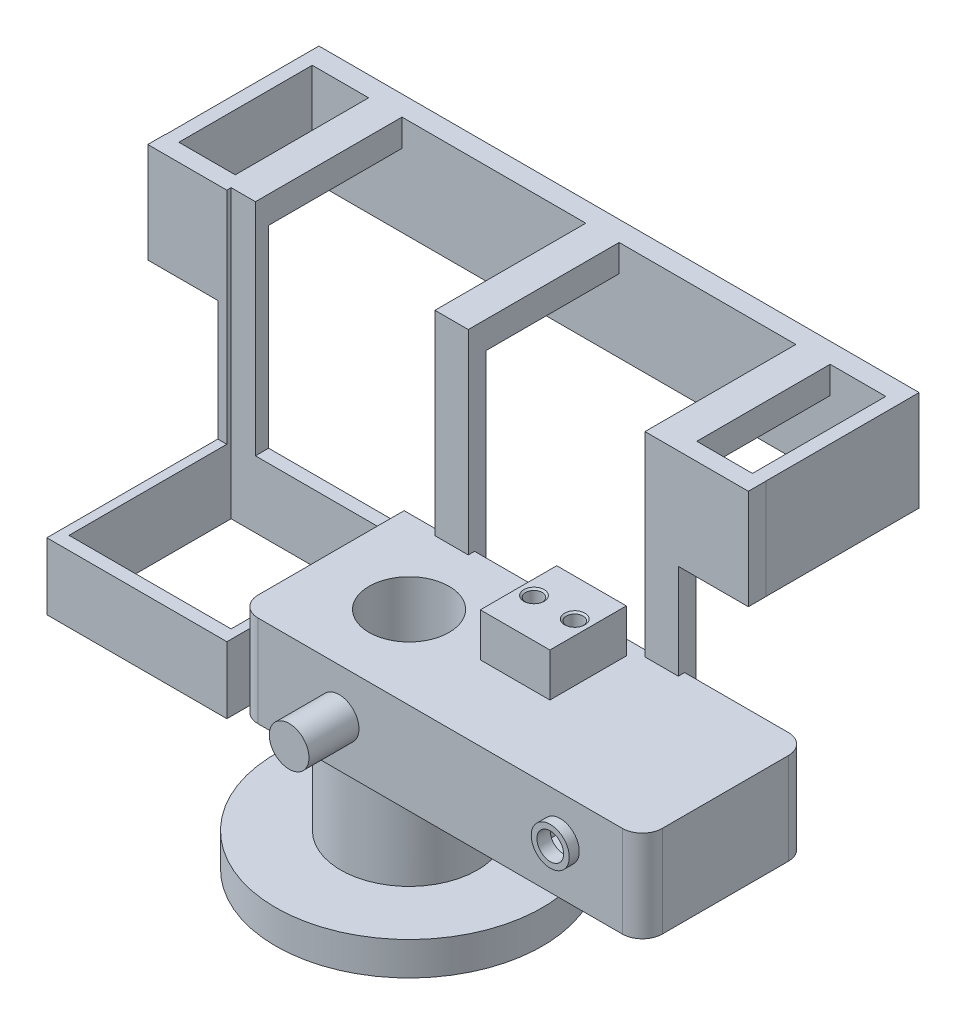
from build123d import *
from build123d.topology import SkipClean

# Parameters (mm, degrees)
SKETCH_1_W                   = 60.60764715
SKETCH_1_H                   = 24.895940982
EXTRUDE_1_DEPTH              = 13.730426318
SKETCH_2_W                   = 12.5
SKETCH_2_H                   = 10.5
CUT_EXTRUDE_1_DEPTH          = 42.553028861
SKETCH_3_W                   = 12.5
SKETCH_3_H                   = 10.5
EXTRUDE_2_DEPTH              = 0.5
SKETCH_4_R                   = 2
CUT_EXTRUDE_2_DEPTH          = 42.255402877
SKETCH_5_R                   = 2.975
EXTRUDE_3_DEPTH              = 7.5
SKETCH_10_W                  = 10.431635196
SKETCH_10_H                  = 11.456709174
EXTRUDE_4_DEPTH              = 6.5
SKETCH_14_R                  = 2.850486714
SKETCH_14_R_2                = 2
EXTRUDE_5_DEPTH              = 1.5
FILLET_2_R                   = 3
FILLET_3_R                   = 3
FILLET_4_R                   = 3
SKETCH_16_R                  = 7.5
SKETCH_16_R_2                = 5.5
EXTRUDE_6_DEPTH              = 15
SKETCH_17_R                  = 17.05
SKETCH_17_R_2                = 9.15
EXTRUDE_7_DEPTH              = 5
SKETCH_18_R                  = 10.251372135
EXTRUDE_8_DEPTH              = 15
SKETCH_19_R                  = 6
CUT_EXTRUDE_3_DEPTH          = 53.976583263
SKETCH_20_W                  = 1.654830839
SKETCH_20_H                  = 3.13
CUT_EXTRUDE_4_DEPTH          = 15
SKETCH_21_W                  = 0.395316647
SKETCH_21_H                  = 3.13
CUT_EXTRUDE_5_DEPTH          = 10
SKETCH_22_R                  = 19.964796935
CUT_EXTRUDE_6_DEPTH          = 10
SKETCH_47_R                  = 20
EXTRUDE_16_DEPTH             = 5
CUT_EXTRUDE_START            = -5
SKETCH_48_R                  = 6
CUT_EXTRUDE_21_DEPTH         = 5
SKETCH_49_R                  = 17.3
SKETCH_49_R_2                = 14.8
CUT_EXTRUDE_22_DEPTH         = 3
CUT_EXTRUDE_23_DEPTH         = 3
CUT_EXTRUDE_START_2          = 2.3
SKETCH_52_R                  = 18.590918847
CUT_EXTRUDE_24_DEPTH         = 2.3
SKETCH_43_W                  = 27
SKETCH_43_H                  = 28.25209616
SKETCH_43_W_2                = 24.3
SKETCH_43_H_2                = 24.3
EXTRUDE_14_DEPTH             = 10
EXTRUDE_17_DEPTH             = 5
SKETCH_54_R                  = 14.8
SKETCH_54_R_2                = 6
EXTRUDE_18_DEPTH             = 5
SKETCH_56_W                  = 1.678077589
SKETCH_56_H                  = 10
EXTRUDE_19_DEPTH             = 80
SKETCH_57_W                  = 12.5
SKETCH_57_H                  = 12
CUT_EXTRUDE_28_DEPTH         = 80
SKETCH_58_W                  = 1.678077589
SKETCH_58_H                  = 10
CUT_EXTRUDE_29_DEPTH         = 18.5
SKETCH_59_W                  = 5
SKETCH_59_H                  = 33
EXTRUDE_21_DEPTH             = 2.620970499
SKETCH_60_W                  = 25
SKETCH_60_H                  = 4.061764596
EXTRUDE_22_DEPTH             = 69.2
SKETCH_61_W                  = 26.493157549
SKETCH_61_H                  = 20
SKETCH_61_W_2                = 27.560666026
CUT_EXTRUDE_30_DEPTH         = 5.2
SKETCH_68_W                  = 86
SKETCH_68_H                  = 15
EXTRUDE_25_DEPTH             = 3
SKETCH_69_W                  = 69.2
SKETCH_69_H                  = 4.061764596
CUT_EXTRUDE_34_DEPTH         = 2
SKETCH_70_W                  = 23
SKETCH_70_H                  = 15
EXTRUDE_27_DEPTH             = 2
SKETCH_71_W                  = 23
SKETCH_71_H                  = 15
EXTRUDE_28_DEPTH             = 2
EXTRUDE_29_DEPTH             = 10.5
EXTRUDE_30_DEPTH             = 10.5
SKETCH_74_W                  = 3.65
SKETCH_74_H                  = 0.644922419
CUT_EXTRUDE_35_DEPTH         = 85.051781286
HOLE_WIZARD_M3_1_D           = 2.5
HOLE_WIZARD_M3_1_DEPTH       = 15
HOLE_WIZARD_M3_1_CSINK_D     = 3.05
HOLE_WIZARD_M3_1_CSINK_ANGLE = 100
HOLE_WIZARD_M3_1_TIP         = 0.751075774


with BuildPart() as part:
    # 草圖1 → 填料-伸長1 (new body)
    with BuildSketch(Plane(origin=(0, 0, 0), x_dir=(1, 0, 0), z_dir=(0, 1, 0))):
        Rectangle(SKETCH_1_W, SKETCH_1_H)
    extrude(amount=EXTRUDE_1_DEPTH)

    # 草圖2 → 除料-伸長1 (cut, through all)
    with BuildSketch(Plane.XY.offset(12.447970491)):
        with Locations((18, 7.5)):
            Rectangle(SKETCH_2_W, SKETCH_2_H)
    extrude(amount=-CUT_EXTRUDE_1_DEPTH, mode=Mode.SUBTRACT)

    # 草圖3 → 填料-伸長2 (add)
    with BuildSketch(Plane.XY.offset(12.447970491)):
        with Locations((18, 7.5)):
            Rectangle(SKETCH_3_W, SKETCH_3_H)
    extrude(amount=-EXTRUDE_2_DEPTH)

    # 草圖4 → 除料-伸長2 (cut, through all)
    with BuildSketch(Plane(origin=(0, 0, 11.947970491), x_dir=(-1, 0, 0), z_dir=(0, 0, -1))):
        with Locations((-18, 7.5)):
            Circle(SKETCH_4_R)
    extrude(amount=-CUT_EXTRUDE_2_DEPTH, mode=Mode.SUBTRACT)

    # 草圖5 → 填料-伸長3 (add)
    with BuildSketch(Plane.XY.offset(12.447970491)):
        with Locations(Location((-15.151911787, 6.9, 0), (0, 0, 180))):
            Circle(SKETCH_5_R)
    extrude(amount=EXTRUDE_3_DEPTH)

    # 草圖10 → 填料-伸長4 (add)
    with BuildSketch(Plane(origin=(0, 13.730426318, 0), x_dir=(1, 0, 0), z_dir=(0, 1, 0))):
        with Locations((0, 4.510890299)):
            Rectangle(SKETCH_10_W, SKETCH_10_H)
    extrude(amount=EXTRUDE_4_DEPTH)

    # 草圖14 → 填料-伸長5 (add)
    with BuildSketch(Plane.XY.offset(12.447970491)):
        with Locations(Location((18, 7.5, 0), (0, 0, 180))):
            Circle(SKETCH_14_R)
        with Locations(Location((18, 7.5, 0), (0, 0, 180))):
            Circle(SKETCH_14_R_2, mode=Mode.SUBTRACT)
    extrude(amount=EXTRUDE_5_DEPTH)

    # 圓角2
    fillet_2_edges = [part.edges().sort_by_distance(p)[0] for p in [
        (-30.303823575, 6.865213159, 12.447970491),
    ]]
    fillet(fillet_2_edges, radius=FILLET_2_R)

    # 圓角3
    fillet_3_edges = [part.edges().sort_by_distance(p)[0] for p in [
        (30.303823575, 6.865213159, -12.447970491),
    ]]
    fillet(fillet_3_edges, radius=FILLET_3_R)

    # 圓角4
    fillet_4_edges = [part.edges().sort_by_distance(p)[0] for p in [
        (30.303823575, 6.865213159, 12.447970491),
    ]]
    fillet(fillet_4_edges, radius=FILLET_4_R)

    # 草圖16 → 填料-伸長6 (add)
    with BuildSketch(Plane.XZ):
        with Locations(Location((-17.11743931, 0, 0), (0, 0, 90))):
            Circle(SKETCH_16_R)
        with Locations(Location((-17.11743931, 0, 0), (0, 0, 270))):
            Circle(SKETCH_16_R_2, mode=Mode.SUBTRACT)
    extrude(amount=EXTRUDE_6_DEPTH)



with BuildPart() as body_2:
    # 草圖17 → 填料-伸長7 (new body)
    with BuildSketch(Plane.XZ.offset(15)):
        with Locations(Location((-17.11743931, 0, 0), (0, 0, 270))):
            Circle(SKETCH_17_R)
        with Locations(Location((-17.11743931, 0, 0), (0, 0, 270))):
            Circle(SKETCH_17_R_2, mode=Mode.SUBTRACT)
    extrude(amount=EXTRUDE_7_DEPTH)


with BuildPart() as part_1:
    add(part.part)

    add(body_2.part)  # 填料-伸長8 merges body 2
    # 草圖18 → 填料-伸長8 (add)
    with BuildSketch(Plane(origin=(0, -15, 0), x_dir=(1, 0, 0), z_dir=(0, 1, 0))):
        with Locations(Location((-17.11743931, 0, 0), (0, 0, 90))):
            Circle(SKETCH_18_R)
    extrude(amount=EXTRUDE_8_DEPTH)

    # 草圖19 → 除料-伸長3 (cut, through all)
    with BuildSketch(Plane.XZ.offset(15)):
        with Locations(Location((-17.11743931, 0, 0), (0, 0, 270))):
            Circle(SKETCH_19_R)
    extrude(amount=-CUT_EXTRUDE_3_DEPTH, mode=Mode.SUBTRACT)

    # 草圖20 → 除料-伸長4 (cut)
    with BuildSketch(Plane.XZ.offset(20)):
        with Locations((-26.960023891, 0)):
            Rectangle(SKETCH_20_W, SKETCH_20_H)
    extrude(amount=-CUT_EXTRUDE_4_DEPTH, mode=Mode.SUBTRACT)

    # 草圖21 → 除料-伸長5 (cut)
    with BuildSketch(Plane.XZ.offset(15)):
        with Locations((-25.934950148, 0)):
            Rectangle(SKETCH_21_W, SKETCH_21_H)
    extrude(amount=-CUT_EXTRUDE_5_DEPTH, mode=Mode.SUBTRACT)

    # 草圖22 → 除料-伸長6 (cut)
    with BuildSketch(Plane(origin=(0, -15, 0), x_dir=(1, 0, 0), z_dir=(0, 1, 0))):
        with Locations((-17.11743931, 0)):
            Circle(SKETCH_22_R)
    extrude(amount=-CUT_EXTRUDE_6_DEPTH, mode=Mode.SUBTRACT)

    # 草圖47 → 填料-伸長16 (add)
    with BuildSketch(Plane.XZ.offset(15)):
        with Locations(Location((-17.11743931, 0, 0), (0, 0, 270))):
            Circle(SKETCH_47_R)
    extrude(amount=EXTRUDE_16_DEPTH)

    # 草圖48 → 除料-伸長21 (cut)
    with BuildSketch(Plane(origin=(0, -15, 0), x_dir=(1, 0, 0), z_dir=(0, 1, 0)).offset(CUT_EXTRUDE_START)):
        with Locations(Location((-17.11743931, 0, 0), (0, 0, 270))):
            Circle(SKETCH_48_R)
    extrude(amount=CUT_EXTRUDE_21_DEPTH, mode=Mode.SUBTRACT)

    # 草圖49 → 除料-伸長22 (cut)
    with BuildSketch(Plane.XZ.offset(20)):
        with Locations(Location((-17.11743931, 0, 0), (0, 0, 270))):
            Circle(SKETCH_49_R)
        with Locations(Location((-17.11743931, 0, 0), (0, 0, 270))):
            Circle(SKETCH_49_R_2, mode=Mode.SUBTRACT)
    extrude(amount=-CUT_EXTRUDE_22_DEPTH, mode=Mode.SUBTRACT)

    # 草圖51 → 除料-伸長23 (cut)
    with BuildSketch(Plane.XZ.offset(20)):
        with BuildLine():
            Line((-3.148700639, 10.206093275), (-2.106359135, 10.967667735))
            ThreePointArc((-2.106359135, 10.967667735), (-0.785172209, 8.881402756), (0.247853998, 6.638437461))
            Line((0.247853998, 6.638437461), (-0.95795969, 6.177476703))
            ThreePointArc((-0.95795969, 6.177476703), (-1.919254477, 8.264694658), (-3.148700639, 10.206093275))
        make_face()
        with BuildLine():
            Line((-15.263072595, -17.200329185), (-15.124700518, -18.483810637))
            ThreePointArc((-15.124700518, -18.483810637), (-17.592052452, -18.584859589), (-20.051030481, -18.358003878))
            Line((-20.051030481, -18.358003878), (-19.847327363, -17.083258214))
            ThreePointArc((-19.847327363, -17.083258214), (-17.559096198, -17.294361486), (-15.263072595, -17.200329185))
        make_face()
        with BuildLine():
            Line((-32.940544695, 6.99423591), (-34.121258276, 7.516142902))
            ThreePointArc((-34.121258276, 7.516142902), (-32.975093268, 9.703456833), (-31.549141446, 11.719566418))
            Line((-31.549141446, 11.719566418), (-30.547030876, 10.905781511))
            ThreePointArc((-30.547030876, 10.905781511), (-31.873967254, 9.029666828), (-32.940544695, 6.99423591))
        make_face()
    extrude(amount=-CUT_EXTRUDE_23_DEPTH, mode=Mode.SUBTRACT)

    # 草圖52 → 除料-伸長24 (cut)
    with BuildSketch(Plane.XZ.offset(17).offset(CUT_EXTRUDE_START_2)):
        with Locations(Location((-17.11743931, 0, 0), (0, 0, 276.153288987))):
            Circle(SKETCH_52_R)
    extrude(amount=-CUT_EXTRUDE_24_DEPTH, mode=Mode.SUBTRACT)


with BuildPart() as cut_extrude_24_piece_1:
    # of the separate pieces the step leaves, piece 1, a body of its own (cut_extrude_24_pieces)
    add(part_1.part.solids().sort_by_distance((-17.11743931, -15, -20))[0])

    # 草圖43 → 填料-伸長14 (add)
    with BuildSketch(Plane.XZ):
        with Locations((-43.803823575, 0)):
            Rectangle(SKETCH_43_W, SKETCH_43_H)
        with Locations((-43.803823575, 0)):
            Rectangle(SKETCH_43_W_2, SKETCH_43_H_2, mode=Mode.SUBTRACT)
    extrude(amount=-EXTRUDE_14_DEPTH)



with BuildPart() as cut_extrude_24_piece_2:
    # of the separate pieces the step leaves, piece 2, a body of its own (cut_extrude_24_pieces)
    add(part_1.part.solids().sort_by_distance((-17.11743931, -20, -14.8))[0])


with BuildPart() as cut_extrude_24_piece_1_1:
    add(cut_extrude_24_piece_1.part)

    add(cut_extrude_24_piece_2.part)  # 填料-伸長17 merges 除料-伸長24 piece 2
    # 草圖53 → 填料-伸長17 (add)
    with BuildSketch(Plane.XZ.offset(20)):
        with BuildLine():
            Line((-21.468420385, 18.074601718), (-18.521667184, 5.83336473))
            ThreePointArc((-18.521667184, 5.83336473), (-17.137610477, 5.999966094), (-15.752464882, 5.842674457))
            Line((-15.752464882, 5.842674457), (-12.888084506, 18.10344778))
            ThreePointArc((-12.888084506, 18.10344778), (-17.1799394, 18.590813788), (-21.468420385, 18.074601718))
        make_face()
        with BuildLine():
            Line((0.711115479, -5.269240716), (-11.363483327, -1.700585353))
            ThreePointArc((-11.363483327, -1.700585353), (-11.911230667, -2.982514303), (-12.740022018, -4.103439759))
            Line((-12.740022018, -4.103439759), (-3.554071038, -12.714452591))
            ThreePointArc((-3.554071038, -12.714452591), (-0.986072247, -9.241280228), (0.711115479, -5.269240716))
        make_face()
        with BuildLine():
            Line((-30.595013023, -12.805361001), (-21.467167419, -4.132779377))
            ThreePointArc((-21.467167419, -4.132779377), (-22.303476785, -3.01745179), (-22.85983103, -1.739234698))
            Line((-22.85983103, -1.739234698), (-34.910162385, -5.388995188))
            ThreePointArc((-34.910162385, -5.388995188), (-33.186306282, -9.34953356), (-30.595013023, -12.805361001))
        make_face()
    extrude(amount=-EXTRUDE_17_DEPTH)

    # 草圖54 → 填料-伸長18 (add)
    with SkipClean():  # the faces are left unmerged after this step: merging them gives an invalid solid
        with BuildSketch(Plane.XZ.offset(20)):
            with Locations((-17.11743931, 0)):
                Circle(SKETCH_54_R)
            with Locations(Location((-17.11743931, 0, 0), (0, 0, 270))):
                Circle(SKETCH_54_R_2, mode=Mode.SUBTRACT)
        extrude(amount=-EXTRUDE_18_DEPTH)

    # 草圖56 → 填料-伸長19 (add)
    with SkipClean():  # the faces are left unmerged after this step: merging them gives an invalid solid
        with BuildSketch(Plane(origin=(30.303823575, 0, 0), x_dir=(0, 0, -1), z_dir=(1, 0, 0))):
            with Locations((13.287009286, 5)):
                Rectangle(SKETCH_56_W, SKETCH_56_H)
        extrude(amount=-EXTRUDE_19_DEPTH)

    # 草圖57 → 除料-伸長28 (cut)
    with SkipClean():  # the faces are left unmerged after this step: merging them gives an invalid solid
        with BuildSketch(Plane(origin=(0, 0, -12.447970491), x_dir=(-1, 0, 0), z_dir=(0, 0, -1))):
            with Locations((-18, 6.75)):
                Rectangle(SKETCH_57_W, SKETCH_57_H)
        extrude(amount=CUT_EXTRUDE_28_DEPTH, mode=Mode.SUBTRACT)

    # 草圖58 → 除料-伸長29 (cut)
    with SkipClean():  # the faces are left unmerged after this step: merging them gives an invalid solid
        with BuildSketch(Plane(origin=(30.303823575, 0, 0), x_dir=(0, 0, -1), z_dir=(1, 0, 0))):
            with Locations((13.287009286, 5)):
                Rectangle(SKETCH_58_W, SKETCH_58_H)
        extrude(amount=-CUT_EXTRUDE_29_DEPTH, mode=Mode.SUBTRACT)

    # 草圖59 → 填料-伸長21 (add)
    with SkipClean():  # the faces are left unmerged after this step: merging them gives an invalid solid
        with BuildSketch(Plane(origin=(0, 0, -14.12604808), x_dir=(-1, 0, 0), z_dir=(0, 0, -1))):
            with Locations((-9.25, 26.5)):
                Rectangle(SKETCH_59_W, SKETCH_59_H)
            with Locations((22.243157549, 26.5)):
                Rectangle(SKETCH_59_W, SKETCH_59_H)
            with Locations((54.803823575, 26.5)):
                Rectangle(SKETCH_59_W, SKETCH_59_H)
        extrude(amount=-EXTRUDE_21_DEPTH)

    # 草圖60 → 填料-伸長22 (add)
    with SkipClean():  # the faces are left unmerged after this step: merging them gives an invalid solid
        with BuildSketch(Plane.ZY.offset(57.303823575)):
            with Locations((-26.62604808, 40.969117702)):
                Rectangle(SKETCH_60_W, SKETCH_60_H)
        extrude(amount=-EXTRUDE_22_DEPTH)

    # 草圖61 → 除料-伸長30 (cut)
    with SkipClean():  # the faces are left unmerged after this step: merging them gives an invalid solid
        with BuildSketch(Plane(origin=(0, 43, 0), x_dir=(1, 0, 0), z_dir=(0, 1, 0))):
            with Locations((-6.496578775, 24.12604808)):
                Rectangle(SKETCH_61_W, SKETCH_61_H)
            with Locations((-38.523490562, 24.12604808)):
                Rectangle(SKETCH_61_W_2, SKETCH_61_H)
        extrude(amount=-CUT_EXTRUDE_30_DEPTH, mode=Mode.SUBTRACT)

    # 草圖68 → 填料-伸長25 (add)
    with SkipClean():  # the faces are left unmerged after this step: merging them gives an invalid solid
        with BuildSketch(Plane.XY.offset(-34.12604808)):
            with Locations((-22.761290065, 35.5)):
                Rectangle(SKETCH_68_W, SKETCH_68_H)
        extrude(amount=-EXTRUDE_25_DEPTH)

    # 草圖69 → 除料-伸長34 (cut)
    with SkipClean():  # the faces are left unmerged after this step: merging them gives an invalid solid
        with BuildSketch(Plane(origin=(0, 0, -39.12604808), x_dir=(-1, 0, 0), z_dir=(0, 0, -1))):
            with Locations((22.703823575, 40.969117702)):
                Rectangle(SKETCH_69_W, SKETCH_69_H)
        extrude(amount=-CUT_EXTRUDE_34_DEPTH, mode=Mode.SUBTRACT)

    # 草圖70 → 填料-伸長27 (add)
    with SkipClean():  # the faces are left unmerged after this step: merging them gives an invalid solid
        with BuildSketch(Plane(origin=(20.238709935, 0, 0), x_dir=(0, 0, -1), z_dir=(1, 0, 0))):
            with Locations((25.62604808, 35.5)):
                Rectangle(SKETCH_70_W, SKETCH_70_H)
        extrude(amount=EXTRUDE_27_DEPTH)

    # 草圖71 → 填料-伸長28 (add)
    with SkipClean():  # the faces are left unmerged after this step: merging them gives an invalid solid
        with BuildSketch(Plane.ZY.offset(65.761290065)):
            with Locations((-25.62604808, 35.5)):
                Rectangle(SKETCH_71_W, SKETCH_71_H)
        extrude(amount=EXTRUDE_28_DEPTH)

    # 草圖72 → 填料-伸長29 (add)
    with SkipClean():  # the faces are left unmerged after this step: merging them gives an invalid solid
        with BuildSketch(Plane.ZY.offset(57.303823575)):
            Polygon((-14.12604808, 43), (-11.505077581, 43), (-11.505077581, 27.997982017), (-14.12604808, 28), align=None)
        extrude(amount=EXTRUDE_29_DEPTH)

    # 草圖73 → 填料-伸長30 (add)
    with SkipClean():  # the faces are left unmerged after this step: merging them gives an invalid solid
        with BuildSketch(Plane(origin=(11.75, 0, 0), x_dir=(0, 0, -1), z_dir=(1, 0, 0))):
            Polygon((11.505077581, 27.997982017), (14.12604808, 28), (14.12604808, 43), (11.505077581, 43), align=None)
        extrude(amount=EXTRUDE_30_DEPTH)

    # 草圖74 → 除料-伸長35 (cut, through all)
    with SkipClean():  # the faces are left unmerged after this step: merging them gives an invalid solid
        with BuildSketch(Plane.XZ.offset(-10)):
            with Locations((-54.128823575, -11.827538791)):
                Rectangle(SKETCH_74_W, SKETCH_74_H)
        extrude(amount=-CUT_EXTRUDE_35_DEPTH, mode=Mode.SUBTRACT)

    # M3 螺紋孔1
    with Locations(Plane(origin=(0, 20.230426318, 0), x_dir=(1, 0, 0), z_dir=(0, 1, 0))):
        with Locations((-3.056797271, 4.670577511), (3.056797271, 4.670577511)):
            CounterSinkHole(HOLE_WIZARD_M3_1_D / 2, HOLE_WIZARD_M3_1_CSINK_D / 2, depth=HOLE_WIZARD_M3_1_DEPTH, counter_sink_angle=HOLE_WIZARD_M3_1_CSINK_ANGLE)
            with Locations((0, 0, -(HOLE_WIZARD_M3_1_DEPTH + HOLE_WIZARD_M3_1_TIP / 2))):  # 118° drill point
                Cone(0, HOLE_WIZARD_M3_1_D / 2, HOLE_WIZARD_M3_1_TIP, mode=Mode.SUBTRACT)


solid = cut_extrude_24_piece_1_1.part
